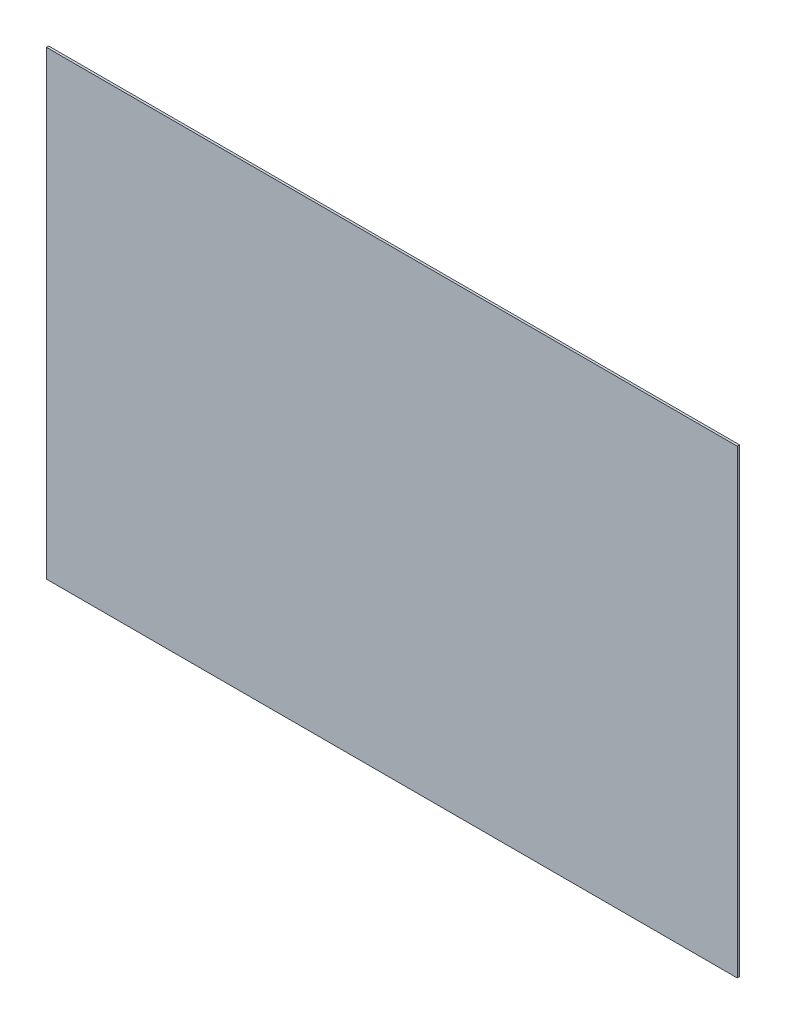
from build123d import *

# Parameters (mm, degrees)
SKETCH_1_W      = 300
SKETCH_1_H      = 200
EXTRUDE_1_DEPTH = 1


with BuildPart() as part:
    # 草图1 → 凸台-拉伸1 (new body)
    with BuildSketch(Plane.XY):
        Rectangle(SKETCH_1_W, SKETCH_1_H)
    extrude(amount=EXTRUDE_1_DEPTH)


solid = part.part
